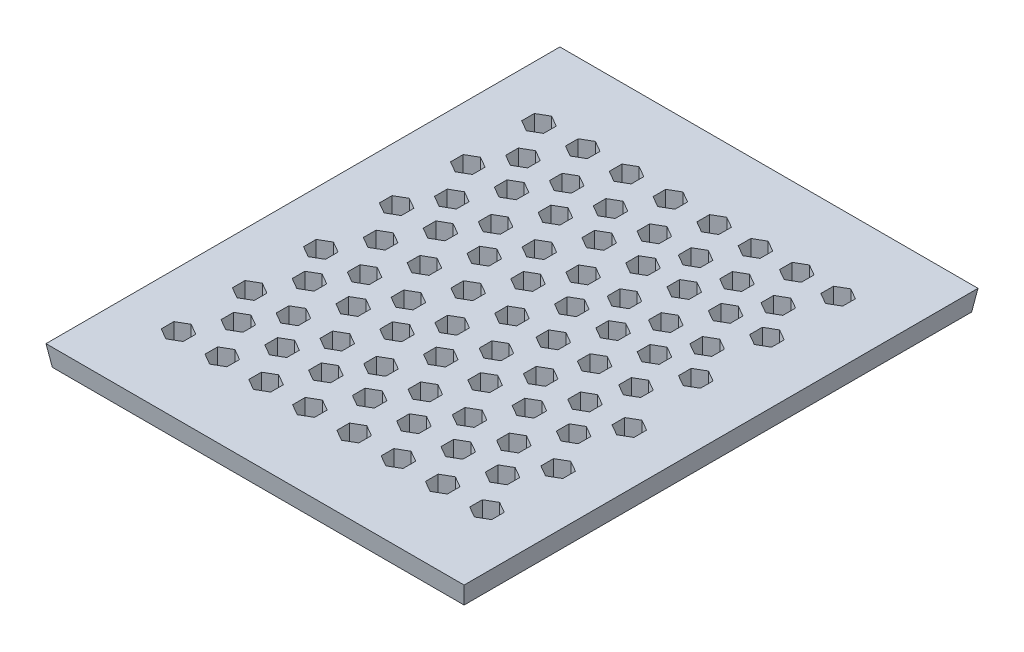
from build123d import *

# Parameters (mm, degrees)
SKETCH1_W           = 152.7689
SKETCH1_H           = 187.7689
BOSS_EXTRUDE1_DEPTH = 7.5
BOSS_EXTRUDE1_DRAFT = -8.77
CUT_EXTRUDE4_DEPTH  = 7.5


with BuildPart() as part:
    # Sketch1 → Boss-Extrude1 (with draft: the straight prism first)
    with BuildSketch(Plane(origin=(0, 0, 0), x_dir=(1, 0, 0), z_dir=(0, 1, 0))):
        Rectangle(SKETCH1_W, SKETCH1_H)
    extrude(amount=-BOSS_EXTRUDE1_DEPTH)
    # Boss-Extrude1: the draft: its side faces are tilted about the plane it starts from
    boss_extrude1_sides = [part.faces().sort_by_distance(p)[0] for p in [
        (-76.38445, -3.75, 0),
        (0, -3.75, 93.88445),
        (76.38445, -3.75, 0),
        (0, -3.75, -93.88445),
    ]]
    draft(boss_extrude1_sides, Plane(origin=(0, 0, 0), x_dir=(1, 0, 0), z_dir=(0, 1, 0)), BOSS_EXTRUDE1_DRAFT)

    # Sketch2 → Cut-Extrude4 (cut)
    with BuildSketch(Plane(origin=(0, 0, 0), x_dir=(1, 0, 0), z_dir=(0, 1, 0))):
        Polygon((15.100576712, -4.618802154), (19.100576712, -2.309401077), (19.100576712, 2.309401077), (15.100576712, 4.618802154), (11.100576712, 2.309401077), (11.100576712, -2.309401077), align=None)
        Polygon((0, -4.618802154), (4, -2.309401077), (4, 2.309401077), (0, 4.618802154), (-4, 2.309401077), (-4, -2.309401077), align=None)
        Polygon((8, 18.475208614), (4, 16.165807537), (4, 11.547005384), (8, 9.237604307), (12, 11.547005384), (12, 16.165807537), align=None)
        Polygon((19.100576712, 11.547005384), (23.100576712, 9.237604307), (27.100576712, 11.547005384), (27.100576712, 16.165807537), (23.100576712, 18.475208614), (19.100576712, 16.165807537), align=None)
        Polygon((30.201153423, -4.618802154), (34.201153423, -2.309401077), (34.201153423, 2.309401077), (30.201153423, 4.618802154), (26.201153423, 2.309401077), (26.201153423, -2.309401077), align=None)
        Polygon((34.201153423, 11.547005384), (38.201153423, 9.237604307), (42.201153423, 11.547005384), (42.201153423, 16.165807537), (38.201153423, 18.475208614), (34.201153423, 16.165807537), align=None)
        Polygon((45.301730135, -4.618802154), (49.301730135, -2.309401077), (49.301730135, 2.309401077), (45.301730135, 4.618802154), (41.301730135, 2.309401077), (41.301730135, -2.309401077), align=None)
        Polygon((49.301730135, 11.547005384), (53.301730135, 9.237604307), (57.301730135, 11.547005384), (57.301730135, 16.165807537), (53.301730135, 18.475208614), (49.301730135, 16.165807537), align=None)
        Polygon((15.100576712, 21.381197846), (19.100576712, 23.690598923), (19.100576712, 28.309401077), (15.100576712, 30.618802154), (11.100576712, 28.309401077), (11.100576712, 23.690598923), align=None)
        Polygon((19.100576712, 37.547005384), (23.100576712, 35.237604307), (27.100576712, 37.547005384), (27.100576712, 42.165807537), (23.100576712, 44.475208614), (19.100576712, 42.165807537), align=None)
        Polygon((30.201153423, 21.381197846), (34.201153423, 23.690598923), (34.201153423, 28.309401077), (30.201153423, 30.618802154), (26.201153423, 28.309401077), (26.201153423, 23.690598923), align=None)
        Polygon((34.201153423, 37.547005384), (38.201153423, 35.237604307), (42.201153423, 37.547005384), (42.201153423, 42.165807537), (38.201153423, 44.475208614), (34.201153423, 42.165807537), align=None)
        Polygon((45.301730135, 21.381197846), (49.301730135, 23.690598923), (49.301730135, 28.309401077), (45.301730135, 30.618802154), (41.301730135, 28.309401077), (41.301730135, 23.690598923), align=None)
        Polygon((49.301730135, 37.547005384), (53.301730135, 35.237604307), (57.301730135, 37.547005384), (57.301730135, 42.165807537), (53.301730135, 44.475208614), (49.301730135, 42.165807537), align=None)
        Polygon((15.100576712, 47.381197846), (19.100576712, 49.690598923), (19.100576712, 54.309401077), (15.100576712, 56.618802154), (11.100576712, 54.309401077), (11.100576712, 49.690598923), align=None)
        Polygon((19.100576712, 63.547005384), (23.100576712, 61.237604307), (27.100576712, 63.547005384), (27.100576712, 68.165807537), (23.100576712, 70.475208614), (19.100576712, 68.165807537), align=None)
        Polygon((30.201153423, 47.381197846), (34.201153423, 49.690598923), (34.201153423, 54.309401077), (30.201153423, 56.618802154), (26.201153423, 54.309401077), (26.201153423, 49.690598923), align=None)
        Polygon((34.201153423, 63.547005384), (38.201153423, 61.237604307), (42.201153423, 63.547005384), (42.201153423, 68.165807537), (38.201153423, 70.475208614), (34.201153423, 68.165807537), align=None)
        Polygon((45.301730135, 47.381197846), (49.301730135, 49.690598923), (49.301730135, 54.309401077), (45.301730135, 56.618802154), (41.301730135, 54.309401077), (41.301730135, 49.690598923), align=None)
        Polygon((49.301730135, 63.547005384), (53.301730135, 61.237604307), (57.301730135, 63.547005384), (57.301730135, 68.165807537), (53.301730135, 70.475208614), (49.301730135, 68.165807537), align=None)
        Polygon((-4, 23.690598923), (0, 21.381197846), (4, 23.690598923), (4, 28.309401077), (0, 30.618802154), (-4, 28.309401077), align=None)
        Polygon((4, 37.547005384), (8, 35.237604307), (12, 37.547005384), (12, 42.165807537), (8, 44.475208614), (4, 42.165807537), align=None)
        Polygon((0, 47.381197846), (4, 49.690598923), (4, 54.309401077), (0, 56.618802154), (-4, 54.309401077), (-4, 49.690598923), align=None)
        Polygon((4, 63.547005384), (8, 61.237604307), (12, 63.547005384), (12, 68.165807537), (8, 70.475208614), (4, 68.165807537), align=None)
        Polygon((-20, -2.309401077), (-16, -4.618802154), (-12, -2.309401077), (-12, 2.309401077), (-16, 4.618802154), (-20, 2.309401077), align=None)
        Polygon((-12, 11.547005384), (-8, 9.237604307), (-4, 11.547005384), (-4, 16.165807537), (-8, 18.475208614), (-12, 16.165807537), align=None)
        Polygon((-36, -2.309401077), (-32, -4.618802154), (-28, -2.309401077), (-28, 2.309401077), (-32, 4.618802154), (-36, 2.309401077), align=None)
        Polygon((-28, 11.547005384), (-24, 9.237604307), (-20, 11.547005384), (-20, 16.165807537), (-24, 18.475208614), (-28, 16.165807537), align=None)
        Polygon((-52, -2.309401077), (-48, -4.618802154), (-44, -2.309401077), (-44, 2.309401077), (-48, 4.618802154), (-52, 2.309401077), align=None)
        Polygon((-44, 11.547005384), (-40, 9.237604307), (-36, 11.547005384), (-36, 16.165807537), (-40, 18.475208614), (-44, 16.165807537), align=None)
        Polygon((-60, 11.547005384), (-56, 9.237604307), (-52, 11.547005384), (-52, 16.165807537), (-56, 18.475208614), (-60, 16.165807537), align=None)
        Polygon((-20, 23.690598923), (-16, 21.381197846), (-12, 23.690598923), (-12, 28.309401077), (-16, 30.618802154), (-20, 28.309401077), align=None)
        Polygon((-12, 37.547005384), (-8, 35.237604307), (-4, 37.547005384), (-4, 42.165807537), (-8, 44.475208614), (-12, 42.165807537), align=None)
        Polygon((-36, 23.690598923), (-32, 21.381197846), (-28, 23.690598923), (-28, 28.309401077), (-32, 30.618802154), (-36, 28.309401077), align=None)
        Polygon((-28, 37.547005384), (-24, 35.237604307), (-20, 37.547005384), (-20, 42.165807537), (-24, 44.475208614), (-28, 42.165807537), align=None)
        Polygon((-52, 23.690598923), (-48, 21.381197846), (-44, 23.690598923), (-44, 28.309401077), (-48, 30.618802154), (-52, 28.309401077), align=None)
        Polygon((-44, 37.547005384), (-40, 35.237604307), (-36, 37.547005384), (-36, 42.165807537), (-40, 44.475208614), (-44, 42.165807537), align=None)
        Polygon((-60, 37.547005384), (-56, 35.237604307), (-52, 37.547005384), (-52, 42.165807537), (-56, 44.475208614), (-60, 42.165807537), align=None)
        Polygon((-20, 49.690598923), (-16, 47.381197846), (-12, 49.690598923), (-12, 54.309401077), (-16, 56.618802154), (-20, 54.309401077), align=None)
        Polygon((-12, 63.547005384), (-8, 61.237604307), (-4, 63.547005384), (-4, 68.165807537), (-8, 70.475208614), (-12, 68.165807537), align=None)
        Polygon((-36, 49.690598923), (-32, 47.381197846), (-28, 49.690598923), (-28, 54.309401077), (-32, 56.618802154), (-36, 54.309401077), align=None)
        Polygon((-28, 63.547005384), (-24, 61.237604307), (-20, 63.547005384), (-20, 68.165807537), (-24, 70.475208614), (-28, 68.165807537), align=None)
        Polygon((-52, 49.690598923), (-48, 47.381197846), (-44, 49.690598923), (-44, 54.309401077), (-48, 56.618802154), (-52, 54.309401077), align=None)
        Polygon((-44, 63.547005384), (-40, 61.237604307), (-36, 63.547005384), (-36, 68.165807537), (-40, 70.475208614), (-44, 68.165807537), align=None)
        Polygon((-60, 63.547005384), (-56, 61.237604307), (-52, 63.547005384), (-52, 68.165807537), (-56, 70.475208614), (-60, 68.165807537), align=None)
        Polygon((-8, -9.237604307), (-12, -11.547005384), (-12, -16.165807537), (-8, -18.475208614), (-4, -16.165807537), (-4, -11.547005384), align=None)
        Polygon((12.180124057, -11.547005384), (8.180124057, -9.237604307), (4.180124057, -11.547005384), (4.180124057, -16.165807537), (8.180124057, -18.475208614), (12.180124057, -16.165807537), align=None)
        Polygon((28.360248115, -11.547005384), (24.360248115, -9.237604307), (20.360248115, -11.547005384), (20.360248115, -16.165807537), (24.360248115, -18.475208614), (28.360248115, -16.165807537), align=None)
        Polygon((44.540372172, -11.547005384), (40.540372172, -9.237604307), (36.540372172, -11.547005384), (36.540372172, -16.165807537), (40.540372172, -18.475208614), (44.540372172, -16.165807537), align=None)
        Polygon((60.72049623, -11.547005384), (56.72049623, -9.237604307), (52.72049623, -11.547005384), (52.72049623, -16.165807537), (56.72049623, -18.475208614), (60.72049623, -16.165807537), align=None)
        Polygon((12.180124057, -28.309401077), (16.180124057, -30.618802154), (20.180124057, -28.309401077), (20.180124057, -23.690598923), (16.180124057, -21.381197846), (12.180124057, -23.690598923), align=None)
        Polygon((12.180124057, -37.547005384), (8.180124057, -35.237604307), (4.180124057, -37.547005384), (4.180124057, -42.165807537), (8.180124057, -44.475208614), (12.180124057, -42.165807537), align=None)
        Polygon((28.360248115, -28.309401077), (32.360248115, -30.618802154), (36.360248115, -28.309401077), (36.360248115, -23.690598923), (32.360248115, -21.381197846), (28.360248115, -23.690598923), align=None)
        Polygon((28.360248115, -37.547005384), (24.360248115, -35.237604307), (20.360248115, -37.547005384), (20.360248115, -42.165807537), (24.360248115, -44.475208614), (28.360248115, -42.165807537), align=None)
        Polygon((44.540372172, -28.309401077), (48.540372172, -30.618802154), (52.540372172, -28.309401077), (52.540372172, -23.690598923), (48.540372172, -21.381197846), (44.540372172, -23.690598923), align=None)
        Polygon((44.540372172, -37.547005384), (40.540372172, -35.237604307), (36.540372172, -37.547005384), (36.540372172, -42.165807537), (40.540372172, -44.475208614), (44.540372172, -42.165807537), align=None)
        Polygon((60.72049623, -37.547005384), (56.72049623, -35.237604307), (52.72049623, -37.547005384), (52.72049623, -42.165807537), (56.72049623, -44.475208614), (60.72049623, -42.165807537), align=None)
        Polygon((12.180124057, -54.309401077), (16.180124057, -56.618802154), (20.180124057, -54.309401077), (20.180124057, -49.690598923), (16.180124057, -47.381197846), (12.180124057, -49.690598923), align=None)
        Polygon((12.180124057, -63.547005384), (8.180124057, -61.237604307), (4.180124057, -63.547005384), (4.180124057, -68.165807537), (8.180124057, -70.475208614), (12.180124057, -68.165807537), align=None)
        Polygon((28.360248115, -54.309401077), (32.360248115, -56.618802154), (36.360248115, -54.309401077), (36.360248115, -49.690598923), (32.360248115, -47.381197846), (28.360248115, -49.690598923), align=None)
        Polygon((28.360248115, -63.547005384), (24.360248115, -61.237604307), (20.360248115, -63.547005384), (20.360248115, -68.165807537), (24.360248115, -70.475208614), (28.360248115, -68.165807537), align=None)
        Polygon((44.540372172, -54.309401077), (48.540372172, -56.618802154), (52.540372172, -54.309401077), (52.540372172, -49.690598923), (48.540372172, -47.381197846), (44.540372172, -49.690598923), align=None)
        Polygon((44.540372172, -63.547005384), (40.540372172, -61.237604307), (36.540372172, -63.547005384), (36.540372172, -68.165807537), (40.540372172, -70.475208614), (44.540372172, -68.165807537), align=None)
        Polygon((60.72049623, -63.547005384), (56.72049623, -61.237604307), (52.72049623, -63.547005384), (52.72049623, -68.165807537), (56.72049623, -70.475208614), (60.72049623, -68.165807537), align=None)
        Polygon((-4, -28.309401077), (0, -30.618802154), (4, -28.309401077), (4, -23.690598923), (0, -21.381197846), (-4, -23.690598923), align=None)
        Polygon((-4, -37.547005384), (-8, -35.237604307), (-12, -37.547005384), (-12, -42.165807537), (-8, -44.475208614), (-4, -42.165807537), align=None)
        Polygon((-4, -54.309401077), (0, -56.618802154), (4, -54.309401077), (4, -49.690598923), (0, -47.381197846), (-4, -49.690598923), align=None)
        Polygon((-4, -63.547005384), (-8, -61.237604307), (-12, -63.547005384), (-12, -68.165807537), (-8, -70.475208614), (-4, -68.165807537), align=None)
        Polygon((-20, -11.547005384), (-24, -9.237604307), (-28, -11.547005384), (-28, -16.165807537), (-24, -18.475208614), (-20, -16.165807537), align=None)
        Polygon((-20, -23.690598923), (-20, -28.309401077), (-16, -30.618802154), (-12, -28.309401077), (-12, -23.690598923), (-16, -21.381197846), align=None)
        Polygon((-36, -11.547005384), (-40, -9.237604307), (-44, -11.547005384), (-44, -16.165807537), (-40, -18.475208614), (-36, -16.165807537), align=None)
        Polygon((-36, -23.690598923), (-36, -28.309401077), (-32, -30.618802154), (-28, -28.309401077), (-28, -23.690598923), (-32, -21.381197846), align=None)
        Polygon((-52, -11.547005384), (-56, -9.237604307), (-60, -11.547005384), (-60, -16.165807537), (-56, -18.475208614), (-52, -16.165807537), align=None)
        Polygon((-52, -23.690598923), (-52, -28.309401077), (-48, -30.618802154), (-44, -28.309401077), (-44, -23.690598923), (-48, -21.381197846), align=None)
        Polygon((-20, -37.547005384), (-24, -35.237604307), (-28, -37.547005384), (-28, -42.165807537), (-24, -44.475208614), (-20, -42.165807537), align=None)
        Polygon((-20, -49.690598923), (-20, -54.309401077), (-16, -56.618802154), (-12, -54.309401077), (-12, -49.690598923), (-16, -47.381197846), align=None)
        Polygon((-36, -37.547005384), (-40, -35.237604307), (-44, -37.547005384), (-44, -42.165807537), (-40, -44.475208614), (-36, -42.165807537), align=None)
        Polygon((-36, -49.690598923), (-36, -54.309401077), (-32, -56.618802154), (-28, -54.309401077), (-28, -49.690598923), (-32, -47.381197846), align=None)
        Polygon((-52, -37.547005384), (-56, -35.237604307), (-60, -37.547005384), (-60, -42.165807537), (-56, -44.475208614), (-52, -42.165807537), align=None)
        Polygon((-52, -49.690598923), (-52, -54.309401077), (-48, -56.618802154), (-44, -54.309401077), (-44, -49.690598923), (-48, -47.381197846), align=None)
        Polygon((-20, -63.547005384), (-24, -61.237604307), (-28, -63.547005384), (-28, -68.165807537), (-24, -70.475208614), (-20, -68.165807537), align=None)
        Polygon((-36, -63.547005384), (-40, -61.237604307), (-44, -63.547005384), (-44, -68.165807537), (-40, -70.475208614), (-36, -68.165807537), align=None)
        Polygon((-52, -63.547005384), (-56, -61.237604307), (-60, -63.547005384), (-60, -68.165807537), (-56, -70.475208614), (-52, -68.165807537), align=None)
    extrude(amount=-CUT_EXTRUDE4_DEPTH, mode=Mode.SUBTRACT)


solid = part.part
